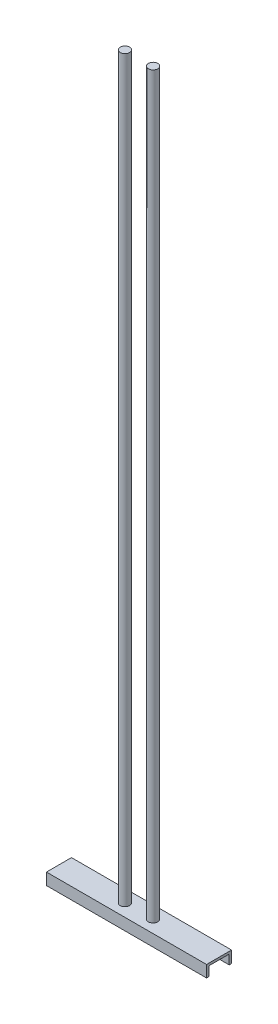
from build123d import *

# Parameters (mm, degrees)
CROQUIS2_W              = 650
CROQUIS2_H              = 101.6
SALIENTE_EXTRUIR1_DEPTH = 9.525
CROQUIS3_W              = 650
CROQUIS3_H              = 9.525
SALIENTE_EXTRUIR2_DEPTH = 38.1
REDONDEO1_R             = 5
CROQUIS4_R              = 19.05
SALIENTE_EXTRUIR3_DEPTH = 3000


with BuildPart() as part:
    # Croquis2 → Saliente-Extruir1 (new body)
    with BuildSketch(Plane(origin=(0, 0, 0), x_dir=(1, 0, 0), z_dir=(0, 1, 0))):
        Rectangle(CROQUIS2_W, CROQUIS2_H)
    extrude(amount=-SALIENTE_EXTRUIR1_DEPTH)

    # Croquis3 → Saliente-Extruir2 (add)
    with BuildSketch(Plane.XZ.offset(9.525)):
        with Locations((0, 46.0375)):
            Rectangle(CROQUIS3_W, CROQUIS3_H)
        with Locations((0, -46.0375)):
            Rectangle(CROQUIS3_W, CROQUIS3_H)
    extrude(amount=SALIENTE_EXTRUIR2_DEPTH)

    # Redondeo1
    redondeo1_edges = [part.edges().sort_by_distance(p)[0] for p in [
        (0, -9.525, 41.275),
        (0, -9.525, -41.275),
    ]]
    fillet(redondeo1_edges, radius=REDONDEO1_R)

    # Croquis4 → Saliente-Extruir3 (add)
    with BuildSketch(Plane(origin=(0, 0, 0), x_dir=(1, 0, 0), z_dir=(0, 1, 0))):
        with Locations(Location((-57.15, 0, 0), (0, 0, 90))):
            Circle(CROQUIS4_R)
        with Locations(Location((57.15, 0, 0), (0, 0, 90))):
            Circle(CROQUIS4_R)
    extrude(amount=SALIENTE_EXTRUIR3_DEPTH)


solid = part.part
